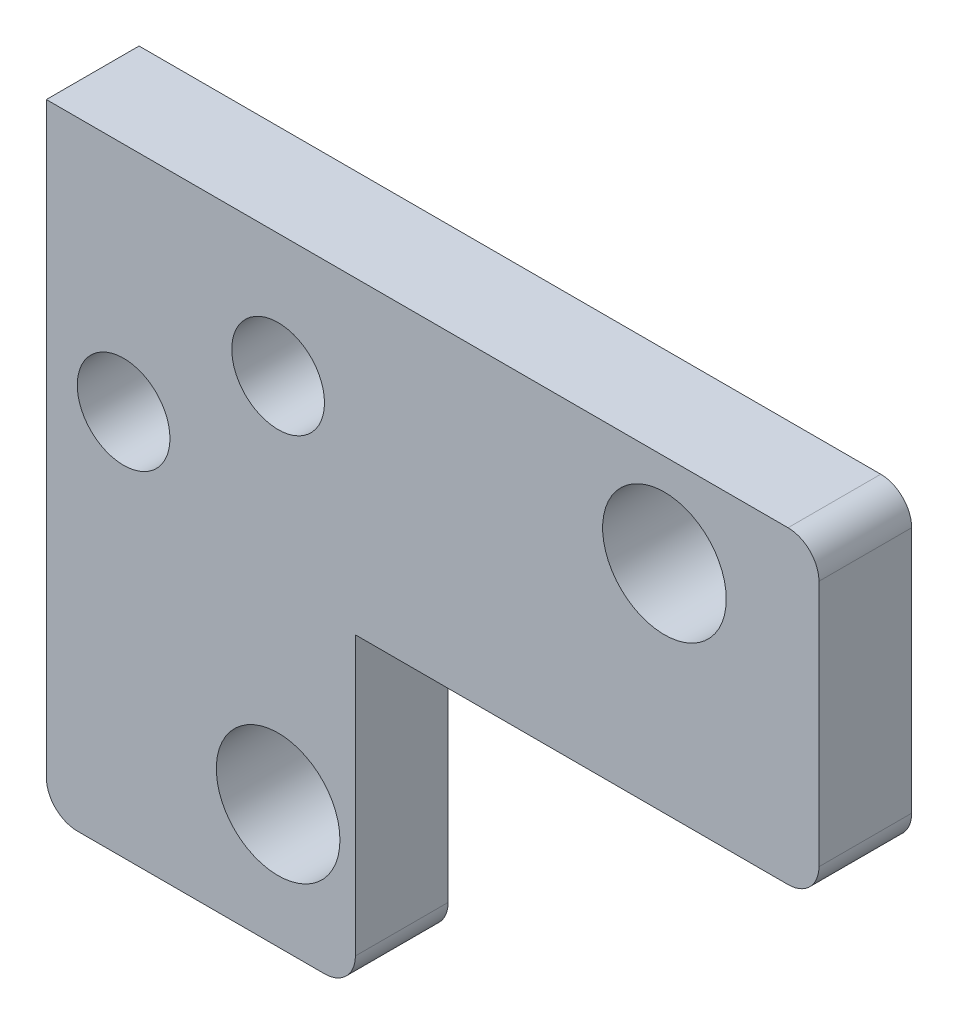
from build123d import *

# Parameters (mm, degrees)
SKETCH_1_W          = 25
SKETCH_1_H          = 10
EXTRUDE_1_DEPTH     = 3
SKETCH_2_R          = 1.5
CUT_EXTRUDE_1_DEPTH = 3
SKETCH_3_R          = 2
CUT_EXTRUDE_2_DEPTH = 10
SKETCH_4_W          = 10
SKETCH_4_H          = 10
EXTRUDE_2_DEPTH     = 3
SKETCH_5_R          = 2
CUT_EXTRUDE_3_DEPTH = 3
FILLET_1_R          = 1


with BuildPart() as part:
    # 草图1 → 凸台-拉伸1 (new body)
    with BuildSketch(Plane.XY):
        with Locations((12.5, 5)):
            Rectangle(SKETCH_1_W, SKETCH_1_H)
    extrude(amount=EXTRUDE_1_DEPTH)

    # 草图2 → 切除-拉伸1 (cut)
    with BuildSketch(Plane.XY.offset(3)):
        with Locations((2.5, 2.5)):
            Circle(SKETCH_2_R)
        with Locations((7.5, 6)):
            Circle(SKETCH_2_R)
    extrude(amount=-CUT_EXTRUDE_1_DEPTH, mode=Mode.SUBTRACT)

    # 草图3 → 切除-拉伸2 (cut)
    with BuildSketch(Plane.XY.offset(3)):
        with Locations((20, 7)):
            Circle(SKETCH_3_R)
    extrude(amount=-CUT_EXTRUDE_2_DEPTH, mode=Mode.SUBTRACT)

    # 草图4 → 凸台-拉伸2 (add)
    with BuildSketch(Plane.XY.offset(3)):
        with Locations((5, -5)):
            Rectangle(SKETCH_4_W, SKETCH_4_H)
    extrude(amount=-EXTRUDE_2_DEPTH)

    # 草图5 → 切除-拉伸3 (cut)
    with BuildSketch(Plane.XY.offset(3)):
        with Locations((7.5, -6)):
            Circle(SKETCH_5_R)
    extrude(amount=-CUT_EXTRUDE_3_DEPTH, mode=Mode.SUBTRACT)

    # 圆角1
    fillet_1_edges = [part.edges().sort_by_distance(p)[0] for p in [
        (0, -10, 1.5),
        (10, -10, 1.5),
        (25, 10, 1.5),
        (25, 0, 1.5),
    ]]
    fillet(fillet_1_edges, radius=FILLET_1_R)


solid = part.part
